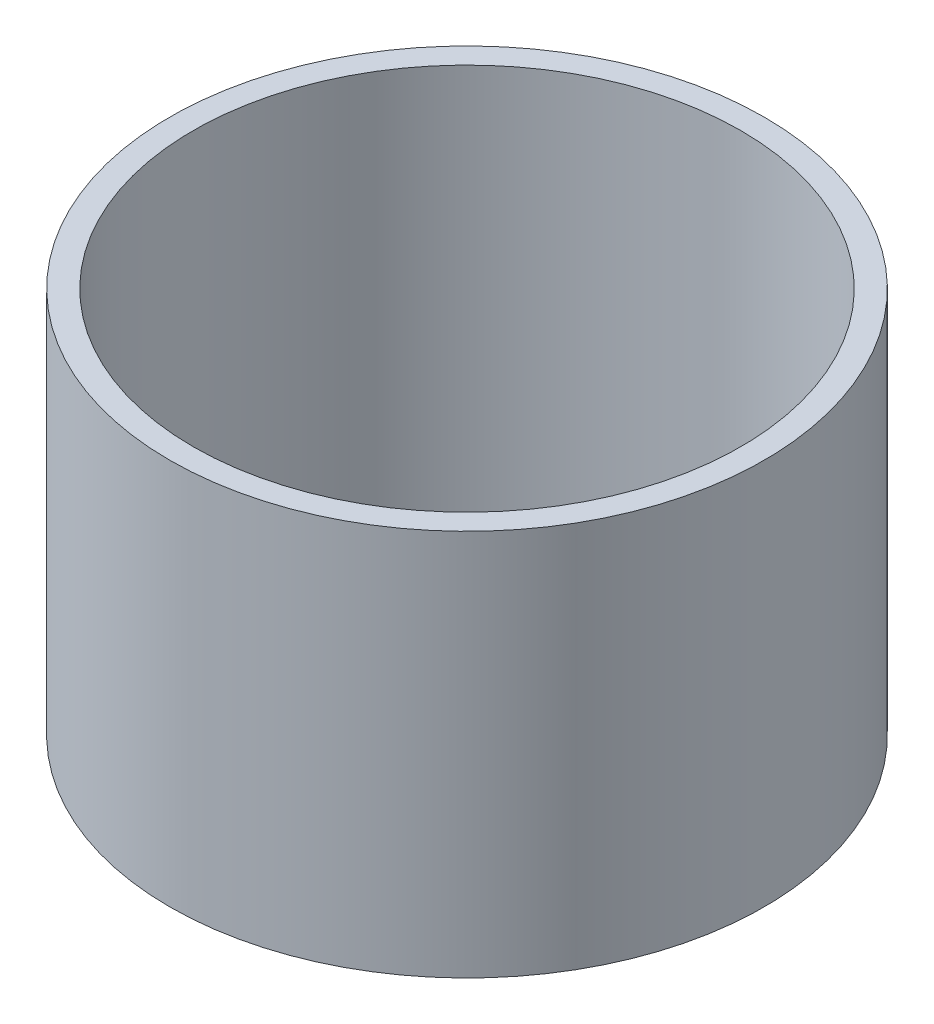
from build123d import *

# Parameters (mm, degrees)
SKETCH1_W = 0.6096
SKETCH1_H = 10.0838


with BuildPart() as part:
    # Sketch1 → Revolve1 (revolve)
    with BuildSketch(Plane(origin=(0, 0, 0), x_dir=(-1, 0, 0), z_dir=(0, 0, -1)), mode=Mode.PRIVATE) as revolve1_sk:
        with Locations((-7.4422, 5.0419)):
            Rectangle(SKETCH1_W, SKETCH1_H)
    revolve(revolve1_sk.sketch.rotate(Axis((0, 0, 0), (0, 1, 0)), 270), axis=Axis((0, 0, 0), (0, 1, 0)))


solid = part.part
